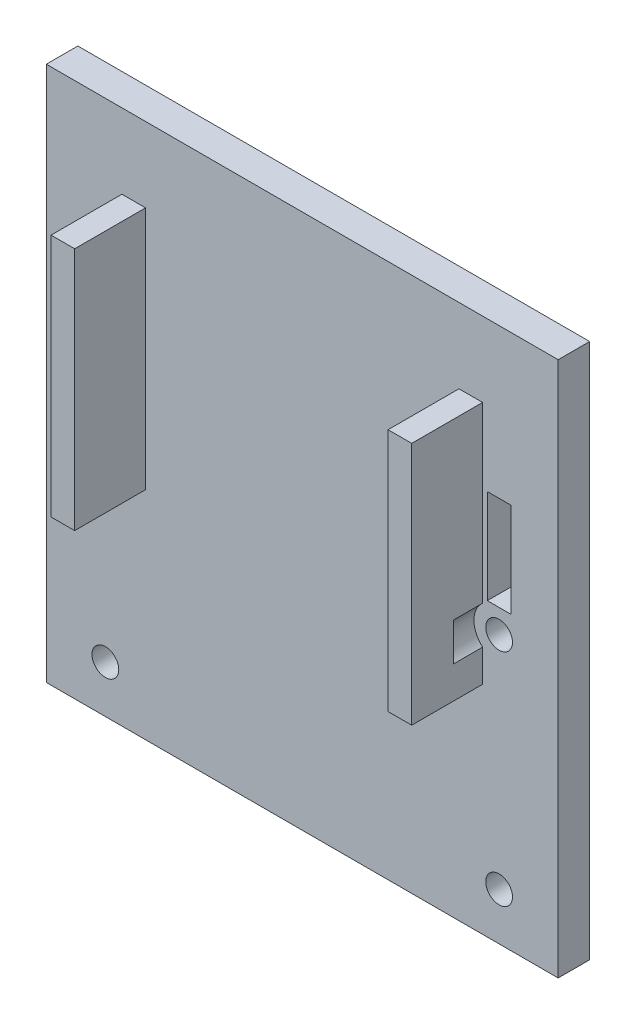
from build123d import *

# Parameters (mm, degrees)
SKETCH_RADAR_SEAT_W             = 65
SKETCH_RADAR_SEAT_H             = 68
RADAR_SEAT_DEPTH                = 4
LATERAL_STOPS_START             = 4
SKETCH_LATERAL_STOPS_W          = 3
SKETCH_LATERAL_STOPS_H          = 31
LATERAL_STOPS_DEPTH             = 9
POST_M3_START                   = -1
SKETCH_POST_M3_R                = 1.7
POST_M3_DEPTH                   = 7
TOP_SCREW_HEAD_RELIEFS_START    = 4
SKETCH_TOP_SCREW_HEAD_RELIEFS_R = 3.2
TOP_SCREW_HEAD_RELIEFS_DEPTH    = 3.7
RETENTION_STRAP_SLOTS_START     = -1
SKETCH_RETENTION_STRAP_SLOTS_W  = 3
SKETCH_RETENTION_STRAP_SLOTS_H  = 12
RETENTION_STRAP_SLOTS_DEPTH     = 7


with BuildPart() as part:
    # Sketch_Radar_seat → Radar_seat (new body)
    with BuildSketch(Plane.XY):
        with Locations((0, -9)):
            Rectangle(SKETCH_RADAR_SEAT_W, SKETCH_RADAR_SEAT_H)
    extrude(amount=RADAR_SEAT_DEPTH)

    # Sketch_Lateral_stops → Lateral_stops (add)
    with BuildSketch(Plane.XY.offset(LATERAL_STOPS_START)):
        with Locations((-21.4, 0)):
            Rectangle(SKETCH_LATERAL_STOPS_W, SKETCH_LATERAL_STOPS_H)
        with Locations((21.4, 0)):
            Rectangle(SKETCH_LATERAL_STOPS_W, SKETCH_LATERAL_STOPS_H)
    extrude(amount=LATERAL_STOPS_DEPTH)

    # Sketch_Post_M3 → Post_M3 (cut)
    with BuildSketch(Plane.XY.offset(POST_M3_START)):
        with Locations((-25, -37)):
            Circle(SKETCH_POST_M3_R)
        with Locations((-25, -9)):
            Circle(SKETCH_POST_M3_R)
        with Locations((25, -37)):
            Circle(SKETCH_POST_M3_R)
        with Locations((25, -9)):
            Circle(SKETCH_POST_M3_R)
    extrude(amount=POST_M3_DEPTH, mode=Mode.SUBTRACT)

    # Sketch_Top_screw_head_reliefs → Top_screw_head_reliefs (cut)
    with BuildSketch(Plane.XY.offset(TOP_SCREW_HEAD_RELIEFS_START)):
        with Locations((-25, -9)):
            Circle(SKETCH_TOP_SCREW_HEAD_RELIEFS_R)
        with Locations((25, -9)):
            Circle(SKETCH_TOP_SCREW_HEAD_RELIEFS_R)
    extrude(amount=TOP_SCREW_HEAD_RELIEFS_DEPTH, mode=Mode.SUBTRACT)

    # Sketch_Retention_strap_slots → Retention_strap_slots (cut)
    with BuildSketch(Plane.XY.offset(RETENTION_STRAP_SLOTS_START)):
        with Locations((-25, 0)):
            Rectangle(SKETCH_RETENTION_STRAP_SLOTS_W, SKETCH_RETENTION_STRAP_SLOTS_H)
        with Locations((25, 0)):
            Rectangle(SKETCH_RETENTION_STRAP_SLOTS_W, SKETCH_RETENTION_STRAP_SLOTS_H)
    extrude(amount=RETENTION_STRAP_SLOTS_DEPTH, mode=Mode.SUBTRACT)


solid = part.part
